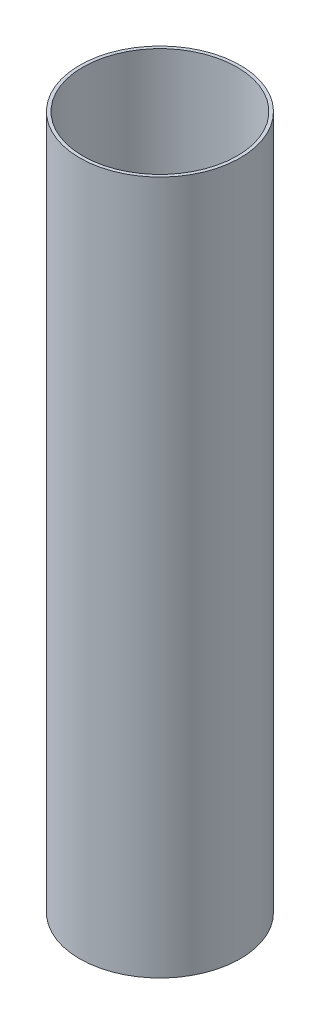
from build123d import *

# Parameters (mm, degrees)
SKETCH1_R           = 79.375
SKETCH1_R_2         = 76.2
BOSS_EXTRUDE1_DEPTH = 685.8


with BuildPart() as part:
    # Sketch1 → Boss-Extrude1 (new body)
    with BuildSketch(Plane(origin=(0, 0, 0), x_dir=(1, 0, 0), z_dir=(0, 1, 0))):
        with Locations(Location((0, 0, 0), (0, 0, 270))):
            Circle(SKETCH1_R)
        with Locations(Location((0, 0, 0), (0, 0, 270))):
            Circle(SKETCH1_R_2, mode=Mode.SUBTRACT)
    extrude(amount=BOSS_EXTRUDE1_DEPTH)


solid = part.part
